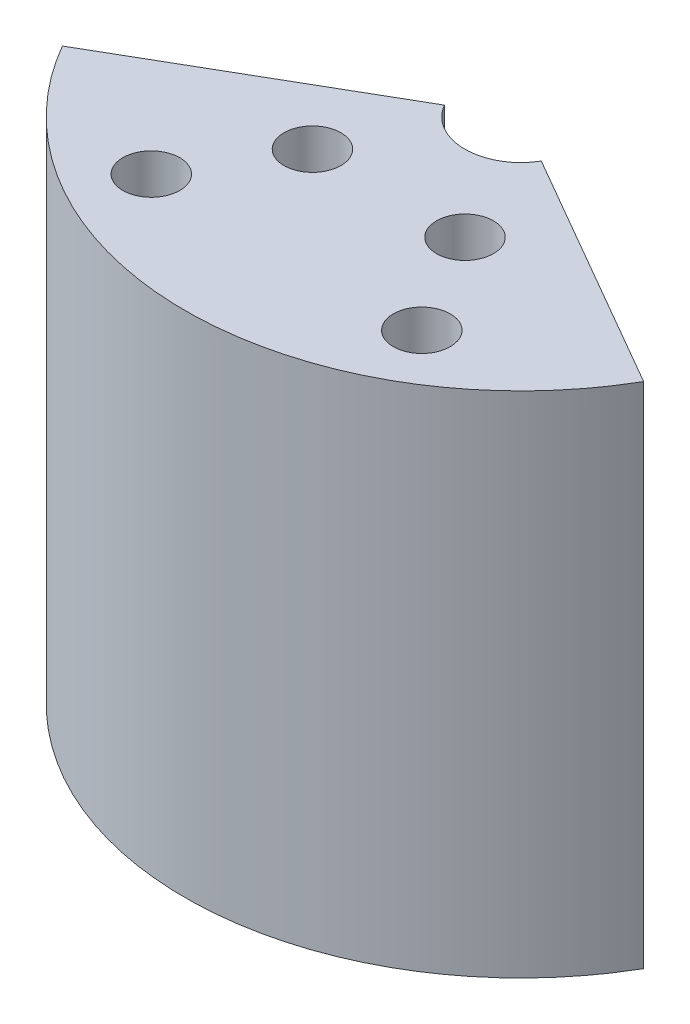
from build123d import *

# Parameters (mm, degrees)
F_3DSKETCH2_R  = 6.999845998
EXTRUDE3_DEPTH = 124.992


with BuildPart() as part:
    # 3DSketch2 → Extrude3 (new body)
    with BuildSketch(Plane(origin=(-18.75, -123.736, 32.476), x_dir=(0.8870183146835777, -1.4196355069849515e-13, 0.4617342411126832), z_dir=(0, -1, 0))):
        with BuildLine():
            Line((84.057647161, -33.864344653), (15.373349185, -36.864404238))
            add(Edge.make_bspline(
                [(15.373349185, -36.864404238), (15.352068384, -36.534110534), (15.309494256, -35.873328697), (15.15380243, -34.89161264), (14.935730394, -33.922345945), (14.643794083, -32.972322164), (14.286702831, -32.044997482), (13.863035519, -31.145928893), (13.374501259, -30.280509448), (12.825956594, -29.451879273), (12.217498956, -28.666136437), (11.555519853, -27.925462519), (10.84179713, -27.234048158), (10.079158018, -26.597430452), (9.273057277, -26.016087573), (8.427361578, -25.494638196), (7.545715962, -25.035700694), (6.633485756, -24.64206797), (5.694906567, -24.315223891), (4.735979636, -24.055686494), (3.760225519, -23.867649672), (2.773801545, -23.750253207), (1.781160185, -23.702549632), (0.787754631, -23.728523084), (-0.2013641, -23.8247555), (-1.180838094, -23.993423853), (-2.145269372, -24.232834664), (-3.090921175, -24.538636337), (-4.009966724, -24.915980503), (-4.903428486, -25.351563375), (-5.469117643, -25.695715914), (-5.751878998, -25.867741552)],
                knots=[0, 0, 0, 0, 0.034470888, 0.068962068, 0.103436508, 0.137919118, 0.17241911, 0.20689509, 0.241383087, 0.275880421, 0.310348632, 0.344841071, 0.379302859, 0.41379577, 0.448262511, 0.482772834, 0.517227166, 0.551737489, 0.58620423, 0.620697141, 0.655158929, 0.689651368, 0.724119579, 0.758616913, 0.79310491, 0.82758089, 0.862080882, 0.896563492, 0.931037932, 0.965529112, 1, 1, 1, 1], degree=3))
            Line((-5.751878998, -25.867741552), (-42.691947897, 32.114707997))
            add(Edge.make_bspline(
                [(84.057647161, -33.864344653), (83.929496966, -31.881927263), (83.673219895, -27.917453198), (82.746706821, -22.024979481), (81.427672342, -16.211783357), (79.684589433, -10.509460987), (77.535515525, -4.948506144), (74.991650083, 0.443580722), (72.065661239, 5.63846846), (68.77170116, 10.608095708), (65.128087834, 15.327241456), (61.152593676, 19.770248775), (56.867676078, 23.91550345), (52.295461541, 27.741669794), (47.45762087, 31.226291453), (42.381892258, 34.353953282), (37.093279559, 37.106921885), (31.61985405, 39.47058486), (25.990484034, 41.43463264), (20.233707282, 42.985186118), (14.380348982, 44.117375042), (8.460577738, 44.825313071), (2.504980102, 45.10300258), (-3.455233166, 44.950602481), (-9.38889544, 44.367574744), (-15.264902994, 43.358422936), (-21.052782359, 41.929020999), (-26.723582946, 40.085969417), (-32.241968491, 37.831968062), (-37.600141517, 35.210965428), (-40.994576154, 33.14685641), (-42.691947897, 32.114707997)],
                knots=[0, 0, 0, 0, 0.034483919, 0.068961564, 0.103450466, 0.137933366, 0.172414368, 0.206896206, 0.241380972, 0.27586552, 0.310346021, 0.3448291, 0.379311579, 0.413791406, 0.448274645, 0.482761184, 0.517238816, 0.551725355, 0.586208594, 0.620688421, 0.6551709, 0.689653979, 0.72413448, 0.758619028, 0.793103794, 0.827585632, 0.862066634, 0.896549534, 0.931038436, 0.965516081, 1, 1, 1, 1], degree=3))
        make_face()
        with Locations(Location((0, 0, 0), (0, 0, 152.500928353))):
            Circle(F_3DSKETCH2_R, mode=Mode.SUBTRACT)
        with Locations(Location((-1.265310097, 28.972611469, 0), (0, 0, 152.500928353))):
            Circle(F_3DSKETCH2_R, mode=Mode.SUBTRACT)
        with Locations(Location((33.263186801, -17.315034042, 0), (0, 0, 152.500928353))):
            Circle(F_3DSKETCH2_R, mode=Mode.SUBTRACT)
        with Locations(Location((57.721407829, -1.732715565, 0), (0, 0, 152.500928353))):
            Circle(F_3DSKETCH2_R, mode=Mode.SUBTRACT)
    extrude(amount=-EXTRUDE3_DEPTH)


solid = part.part
